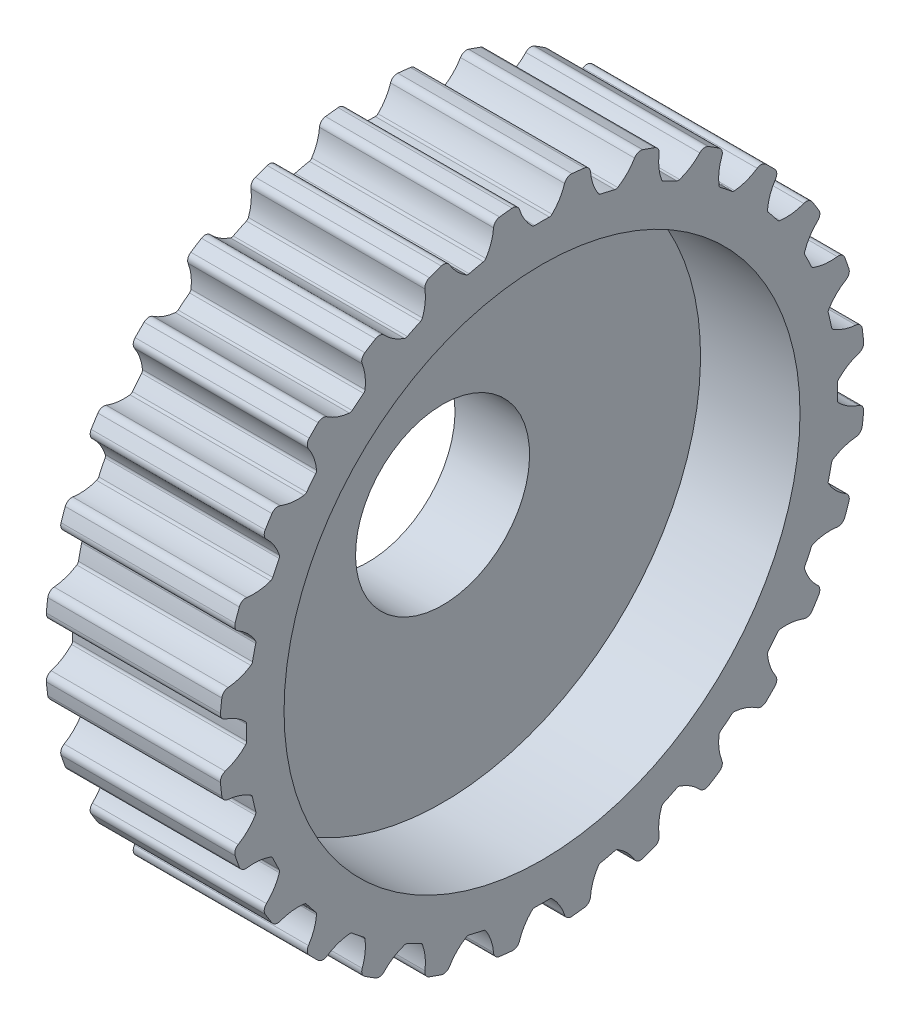
from build123d import *

# Parameters (mm, degrees)
SKETCH_2_W               = 11
SKETCH_2_H               = 3.5
SKETCH_3_R               = 17.99
CUT_EXTRUDE_1_DEPTH      = 7
CUT_EXTRUDE_2_DEPTH      = 24.895606291
CUT_EXTRUDE_2_DEPTH_BACK = 24.895606291
SKETCH_4_W               = 11.336535362
SKETCH_4_H               = 74.847651601
SKETCH_4_W_2             = 15.910926824
SKETCH_4_H_2             = 72.063239407
CUT_EXTRUDE_3_DEPTH      = 20.587141944
CUT_EXTRUDE_3_DEPTH_BACK = 4
SKETCH_5_R               = 10.375


with BuildPart() as part:
    # 草图1 → 旋转1 (revolve)
    with BuildSketch(Plane.XY, mode=Mode.PRIVATE) as revolve_1_sk:
        Polygon((0, 0), (0, 10), (1, 10), (1, 12.858347502), (0.495496297, 14.741180955), (1.461422123, 15), (2, 12.99), (9, 12.99), (9.538577877, 15), (10.504503703, 14.741180955), (10, 12.858347502), (10, 10), (11, 10), (11, 0), align=None)
    revolve(revolve_1_sk.sketch.rotate(Axis((11, 0, 0), (-1, 0, 0)), 270), axis=Axis((11, 0, 0), (-1, 0, 0)))

    # 草图2 → 切除-旋转1 (revolve, cut)
    with BuildSketch(Plane.XY, mode=Mode.PRIVATE) as cut_revolve_1_sk:
        with Locations((5.5, 1.75)):
            Rectangle(SKETCH_2_W, SKETCH_2_H)
    revolve(cut_revolve_1_sk.sketch.rotate(Axis((11, 0, 0), (-1, 0, 0)), 270), axis=Axis((11, 0, 0), (-1, 0, 0)), mode=Mode.SUBTRACT)

    # 草图3 → 切除-拉伸1 (cut)
    with BuildSketch(Plane(origin=(2, 0, 0), x_dir=(0, 0, -1), z_dir=(1, 0, 0))):
        Circle(SKETCH_3_R)
        with BuildLine():
            ThreePointArc((-12.934335103, 1.201280746), (-12.888789145, 1.020492007), (-12.739828866, 0.908376719))
            ThreePointArc((-12.739828866, 0.908376719), (-12.297942757, 0.706183324), (-11.918804329, 0.402210374))
            ThreePointArc((-11.918804329, 0.402210374), (-11.886657294, 0.352337458), (-11.876364008, 0.293901271))
            ThreePointArc((-11.876364008, 0.293901271), (-11.88, 0), (-11.876364008, -0.293901271))
            ThreePointArc((-11.876364008, -0.293901271), (-11.886657302, -0.352337477), (-11.918804359, -0.402210404))
            ThreePointArc((-11.918804359, -0.402210404), (-12.297942801, -0.706183351), (-12.739828923, -0.908376737))
            ThreePointArc((-12.739828923, -0.908376737), (-12.888789162, -1.020492032), (-12.934335103, -1.201280746))
            ThreePointArc((-12.934335103, -1.201280746), (-12.908321607, -1.454418545), (-12.877354431, -1.706998197))
            ThreePointArc((-12.877354431, -1.706998197), (-12.792721126, -1.873119256), (-12.622547594, -1.9492768))
            ThreePointArc((-12.622547594, -1.9492768), (-12.146748229, -2.048071874), (-11.709475248, -2.260057351))
            ThreePointArc((-11.709475248, -2.260057351), (-11.667036439, -2.301526461), (-11.643997952, -2.356207058))
            ThreePointArc((-11.643997952, -2.356207058), (-11.582143597, -2.643548695), (-11.513199581, -2.929272164))
            ThreePointArc((-11.513199581, -2.929272164), (-11.510231522, -2.988533726), (-11.530474814, -3.044309627))
            ThreePointArc((-11.530474814, -3.044309627), (-11.83246712, -3.425027578), (-12.218281974, -3.720480466))
            ThreePointArc((-12.218281974, -3.720480466), (-12.338559474, -3.862931583), (-12.342734194, -4.049322488))
            ThreePointArc((-12.342734194, -4.049322488), (-12.261044455, -4.29032503), (-12.174649437, -4.529681124))
            ThreePointArc((-12.174649437, -4.529681124), (-12.055172652, -4.672804499), (-11.872319078, -4.70918544))
            ThreePointArc((-11.872319078, -4.70918544), (-11.386465071, -4.699628192), (-10.912984272, -4.808996331))
            ThreePointArc((-10.912984272, -4.808996331), (-10.862381694, -4.8399822), (-10.827753217, -4.888165327))
            ThreePointArc((-10.827753217, -4.888165327), (-10.703510151, -5.154538821), (-10.572715252, -5.417757118))
            ThreePointArc((-10.572715252, -5.417757118), (-10.556634671, -5.474872414), (-10.563959116, -5.533754454))
            ThreePointArc((-10.563959116, -5.533754454), (-10.77366213, -5.97212662), (-11.084059347, -6.346023769))
            ThreePointArc((-11.084059347, -6.346023769), (-11.169622884, -6.511667605), (-11.132217052, -6.694314267))
            ThreePointArc((-11.132217052, -6.694314267), (-10.998947337, -6.911096691), (-10.861456683, -7.125226924))
            ThreePointArc((-10.861456683, -7.125226924), (-10.713127484, -7.238175812), (-10.526762909, -7.232955859))
            ThreePointArc((-10.526762909, -7.232955859), (-10.05521696, -7.115525543), (-9.569270608, -7.116792206))
            ThreePointArc((-9.569270608, -7.116792206), (-9.513041742, -7.135741063), (-9.468559724, -7.175010575))
            ThreePointArc((-9.468559724, -7.175010575), (-9.288158012, -7.407058846), (-9.102070833, -7.634573108))
            ThreePointArc((-9.102070833, -7.634573108), (-9.073684076, -7.686678138), (-9.067722396, -7.745713725))
            ThreePointArc((-9.067722396, -7.745713725), (-9.174620733, -8.219758296), (-9.394035702, -8.653350942))
            ThreePointArc((-9.394035702, -8.653350942), (-9.440594761, -8.833881415), (-9.363484071, -9.003625161))
            ThreePointArc((-9.363484071, -9.003625161), (-9.185317076, -9.185317099), (-9.003625138, -9.363484094))
            ThreePointArc((-9.003625138, -9.363484094), (-8.833881369, -9.440594765), (-8.653350892, -9.394035669))
            ThreePointArc((-8.653350892, -9.394035669), (-8.219758288, -9.17462073), (-7.745713767, -9.0677224))
            ThreePointArc((-7.745713767, -9.0677224), (-7.686678158, -9.07368407), (-7.634573108, -9.102070833))
            ThreePointArc((-7.634573108, -9.102070833), (-7.407058846, -9.288158012), (-7.175010575, -9.468559724))
            ThreePointArc((-7.175010575, -9.468559724), (-7.135741074, -9.513041724), (-7.116792211, -9.569270566))
            ThreePointArc((-7.116792211, -9.569270566), (-7.115525544, -10.055216969), (-7.23295588, -10.526762965))
            ThreePointArc((-7.23295588, -10.526762965), (-7.238175796, -10.713127532), (-7.12522689, -10.861456706))
            ThreePointArc((-7.12522689, -10.861456706), (-6.911096656, -10.998947359), (-6.694314232, -11.132217073))
            ThreePointArc((-6.694314232, -11.132217073), (-6.511667555, -11.169622877), (-6.346023728, -11.084059304))
            ThreePointArc((-6.346023728, -11.084059304), (-5.972126613, -10.773662125), (-5.533754494, -10.563959129))
            ThreePointArc((-5.533754494, -10.563959129), (-5.474872435, -10.556634669), (-5.417757118, -10.572715252))
            ThreePointArc((-5.417757118, -10.572715252), (-5.154538821, -10.703510151), (-4.888165327, -10.827753217))
            ThreePointArc((-4.888165327, -10.827753217), (-4.839982218, -10.862381675), (-4.808996348, -10.912984224))
            ThreePointArc((-4.808996348, -10.912984224), (-4.699628191, -11.386465075), (-4.709185449, -11.872319137))
            ThreePointArc((-4.709185449, -11.872319137), (-4.672804473, -12.055172696), (-4.529681085, -12.174649452))
            ThreePointArc((-4.529681085, -12.174649452), (-4.290324995, -12.261044468), (-4.049322457, -12.342734204))
            ThreePointArc((-4.049322457, -12.342734204), (-3.86293154, -12.338559457), (-3.720480436, -12.218281922))
            ThreePointArc((-3.720480436, -12.218281922), (-3.425027542, -11.832467084), (-3.044309591, -11.530474792))
            ThreePointArc((-3.044309591, -11.530474792), (-2.988533705, -11.510231519), (-2.929272164, -11.513199581))
            ThreePointArc((-2.929272164, -11.513199581), (-2.643548695, -11.582143597), (-2.356207058, -11.643997952))
            ThreePointArc((-2.356207058, -11.643997952), (-2.301526443, -11.667036451), (-2.260057328, -11.709475284))
            ThreePointArc((-2.260057328, -11.709475284), (-2.048071858, -12.146748277), (-1.949276795, -12.622547653))
            ThreePointArc((-1.949276795, -12.622547653), (-1.873119224, -12.79272116), (-1.706998165, -12.877354436))
            ThreePointArc((-1.706998165, -12.877354436), (-1.454418528, -12.908321608), (-1.201280746, -12.934335103))
            ThreePointArc((-1.201280746, -12.934335103), (-1.020492007, -12.888789145), (-0.908376719, -12.739828866))
            ThreePointArc((-0.908376719, -12.739828866), (-0.706183324, -12.297942757), (-0.402210374, -11.918804329))
            ThreePointArc((-0.402210374, -11.918804329), (-0.352337458, -11.886657294), (-0.293901271, -11.876364008))
            ThreePointArc((-0.293901271, -11.876364008), (0, -11.88), (0.293901271, -11.876364008))
            ThreePointArc((0.293901271, -11.876364008), (0.352337477, -11.886657302), (0.402210404, -11.918804359))
            ThreePointArc((0.402210404, -11.918804359), (0.706183351, -12.297942801), (0.908376737, -12.739828923))
            ThreePointArc((0.908376737, -12.739828923), (1.020492032, -12.888789162), (1.201280746, -12.934335103))
            ThreePointArc((1.201280746, -12.934335103), (1.454418545, -12.908321607), (1.706998197, -12.877354431))
            ThreePointArc((1.706998197, -12.877354431), (1.873119256, -12.792721126), (1.9492768, -12.622547594))
            ThreePointArc((1.9492768, -12.622547594), (2.048071876, -12.146748225), (2.260057356, -11.709475241))
            ThreePointArc((2.260057356, -11.709475241), (2.301526465, -11.667036436), (2.356207058, -11.643997952))
            ThreePointArc((2.356207058, -11.643997952), (2.643548695, -11.582143597), (2.929272164, -11.513199581))
            ThreePointArc((2.929272164, -11.513199581), (2.988533726, -11.510231522), (3.044309627, -11.530474814))
            ThreePointArc((3.044309627, -11.530474814), (3.425027578, -11.83246712), (3.720480466, -12.218281974))
            ThreePointArc((3.720480466, -12.218281974), (3.862931583, -12.338559474), (4.049322488, -12.342734194))
            ThreePointArc((4.049322488, -12.342734194), (4.29032503, -12.261044455), (4.529681124, -12.174649437))
            ThreePointArc((4.529681124, -12.174649437), (4.672804499, -12.055172652), (4.70918544, -11.872319078))
            ThreePointArc((4.70918544, -11.872319078), (4.699628192, -11.386465071), (4.808996331, -10.912984272))
            ThreePointArc((4.808996331, -10.912984272), (4.8399822, -10.862381694), (4.888165327, -10.827753217))
            ThreePointArc((4.888165327, -10.827753217), (5.154538821, -10.703510151), (5.417757118, -10.572715252))
            ThreePointArc((5.417757118, -10.572715252), (5.474872414, -10.556634671), (5.533754454, -10.563959116))
            ThreePointArc((5.533754454, -10.563959116), (5.97212662, -10.77366213), (6.346023769, -11.084059347))
            ThreePointArc((6.346023769, -11.084059347), (6.511667605, -11.169622884), (6.694314267, -11.132217052))
            ThreePointArc((6.694314267, -11.132217052), (6.911096691, -10.998947337), (7.125226924, -10.861456683))
            ThreePointArc((7.125226924, -10.861456683), (7.238175812, -10.713127484), (7.232955859, -10.526762909))
            ThreePointArc((7.232955859, -10.526762909), (7.115525543, -10.055216965), (7.116792205, -9.569270617))
            ThreePointArc((7.116792205, -9.569270617), (7.135741061, -9.513041746), (7.175010575, -9.468559724))
            ThreePointArc((7.175010575, -9.468559724), (7.407058846, -9.288158012), (7.634573108, -9.102070833))
            ThreePointArc((7.634573108, -9.102070833), (7.686678138, -9.073684076), (7.745713725, -9.067722396))
            ThreePointArc((7.745713725, -9.067722396), (8.219758296, -9.174620733), (8.653350942, -9.394035702))
            ThreePointArc((8.653350942, -9.394035702), (8.833881415, -9.440594761), (9.003625161, -9.363484071))
            ThreePointArc((9.003625161, -9.363484071), (9.185317099, -9.185317076), (9.363484094, -9.003625138))
            ThreePointArc((9.363484094, -9.003625138), (9.440594765, -8.833881369), (9.394035669, -8.653350892))
            ThreePointArc((9.394035669, -8.653350892), (9.17462073, -8.219758288), (9.0677224, -7.745713767))
            ThreePointArc((9.0677224, -7.745713767), (9.07368407, -7.686678158), (9.102070833, -7.634573108))
            ThreePointArc((9.102070833, -7.634573108), (9.288158012, -7.407058846), (9.468559724, -7.175010575))
            ThreePointArc((9.468559724, -7.175010575), (9.513041724, -7.135741074), (9.569270566, -7.116792211))
            ThreePointArc((9.569270566, -7.116792211), (10.05521691, -7.115525537), (10.526762854, -7.232955838))
            ThreePointArc((10.526762854, -7.232955838), (10.713127436, -7.238175827), (10.86145666, -7.125226959))
            ThreePointArc((10.86145666, -7.125226959), (10.998947337, -6.911096691), (11.132217073, -6.694314232))
            ThreePointArc((11.132217073, -6.694314232), (11.169622877, -6.511667555), (11.084059304, -6.346023728))
            ThreePointArc((11.084059304, -6.346023728), (10.773662125, -5.972126613), (10.563959129, -5.533754494))
            ThreePointArc((10.563959129, -5.533754494), (10.556634669, -5.474872435), (10.572715252, -5.417757118))
            ThreePointArc((10.572715252, -5.417757118), (10.703510151, -5.154538821), (10.827753217, -4.888165327))
            ThreePointArc((10.827753217, -4.888165327), (10.862381675, -4.839982218), (10.912984224, -4.808996348))
            ThreePointArc((10.912984224, -4.808996348), (11.386465016, -4.699628198), (11.872319019, -4.709185432))
            ThreePointArc((11.872319019, -4.709185432), (12.055172645, -4.672804503), (12.174649452, -4.529681085))
            ThreePointArc((12.174649452, -4.529681085), (12.261044468, -4.290324995), (12.342734204, -4.049322457))
            ThreePointArc((12.342734204, -4.049322457), (12.338559457, -3.86293154), (12.218281922, -3.720480436))
            ThreePointArc((12.218281922, -3.720480436), (11.832467117, -3.425027575), (11.530474841, -3.044309671))
            ThreePointArc((11.530474841, -3.044309671), (11.510231526, -2.988533751), (11.513199581, -2.929272164))
            ThreePointArc((11.513199581, -2.929272164), (11.582143597, -2.643548695), (11.643997952, -2.356207058))
            ThreePointArc((11.643997952, -2.356207058), (11.667036451, -2.301526443), (11.709475284, -2.260057328))
            ThreePointArc((11.709475284, -2.260057328), (12.146748281, -2.048071857), (12.62254766, -1.949276795))
            ThreePointArc((12.62254766, -1.949276795), (12.792721162, -1.873119222), (12.877354436, -1.706998165))
            ThreePointArc((12.877354436, -1.706998165), (12.908321608, -1.454418528), (12.934335103, -1.201280746))
            ThreePointArc((12.934335103, -1.201280746), (12.888789145, -1.020492007), (12.739828866, -0.908376719))
            ThreePointArc((12.739828866, -0.908376719), (12.297942793, -0.706183346), (11.918804388, -0.402210435))
            ThreePointArc((11.918804388, -0.402210435), (11.88665731, -0.352337497), (11.876364008, -0.293901271))
            ThreePointArc((11.876364008, -0.293901271), (11.88, 0), (11.876364008, 0.293901271))
            ThreePointArc((11.876364008, 0.293901271), (11.886657302, 0.352337477), (11.918804359, 0.402210404))
            ThreePointArc((11.918804359, 0.402210404), (12.297942804, 0.706183353), (12.73982893, 0.908376739))
            ThreePointArc((12.73982893, 0.908376739), (12.888789164, 1.020492035), (12.934335103, 1.201280746))
            ThreePointArc((12.934335103, 1.201280746), (12.908321607, 1.454418545), (12.877354431, 1.706998197))
            ThreePointArc((12.877354431, 1.706998197), (12.792721126, 1.873119256), (12.622547594, 1.9492768))
            ThreePointArc((12.622547594, 1.9492768), (12.146748274, 2.048071859), (11.709475327, 2.2600573))
            ThreePointArc((11.709475327, 2.2600573), (11.667036465, 2.301526422), (11.643997952, 2.356207058))
            ThreePointArc((11.643997952, 2.356207058), (11.582143597, 2.643548695), (11.513199581, 2.929272164))
            ThreePointArc((11.513199581, 2.929272164), (11.510231522, 2.988533726), (11.530474814, 3.044309627))
            ThreePointArc((11.530474814, 3.044309627), (11.832467125, 3.425027582), (12.218281985, 3.720480472))
            ThreePointArc((12.218281985, 3.720480472), (12.338559476, 3.862931589), (12.342734194, 4.049322488))
            ThreePointArc((12.342734194, 4.049322488), (12.261044455, 4.29032503), (12.174649437, 4.529681124))
            ThreePointArc((12.174649437, 4.529681124), (12.055172652, 4.672804499), (11.872319078, 4.70918544))
            ThreePointArc((11.872319078, 4.70918544), (11.386465071, 4.699628192), (10.912984272, 4.808996331))
            ThreePointArc((10.912984272, 4.808996331), (10.862381694, 4.8399822), (10.827753217, 4.888165327))
            ThreePointArc((10.827753217, 4.888165327), (10.703510151, 5.154538821), (10.572715252, 5.417757118))
            ThreePointArc((10.572715252, 5.417757118), (10.556634671, 5.474872414), (10.563959116, 5.533754454))
            ThreePointArc((10.563959116, 5.533754454), (10.773662094, 5.972126564), (11.084059251, 6.346023678))
            ThreePointArc((11.084059251, 6.346023678), (11.169622875, 6.51166754), (11.132217052, 6.694314267))
            ThreePointArc((11.132217052, 6.694314267), (10.998947337, 6.911096691), (10.861456683, 7.125226924))
            ThreePointArc((10.861456683, 7.125226924), (10.713127484, 7.238175812), (10.526762909, 7.232955859))
            ThreePointArc((10.526762909, 7.232955859), (10.055216918, 7.115525538), (9.569270524, 7.116792217))
            ThreePointArc((9.569270524, 7.116792217), (9.513041706, 7.135741084), (9.468559724, 7.175010575))
            ThreePointArc((9.468559724, 7.175010575), (9.288158012, 7.407058846), (9.102070833, 7.634573108))
            ThreePointArc((9.102070833, 7.634573108), (9.073684076, 7.686678138), (9.067722396, 7.745713725))
            ThreePointArc((9.067722396, 7.745713725), (9.174620713, 8.21975824), (9.394035635, 8.653350843))
            ThreePointArc((9.394035635, 8.653350843), (9.440594766, 8.833881356), (9.363484071, 9.003625161))
            ThreePointArc((9.363484071, 9.003625161), (9.185317076, 9.185317099), (9.003625138, 9.363484094))
            ThreePointArc((9.003625138, 9.363484094), (8.833881369, 9.440594765), (8.653350892, 9.394035669))
            ThreePointArc((8.653350892, 9.394035669), (8.219758248, 9.174620716), (7.745713683, 9.067722391))
            ThreePointArc((7.745713683, 9.067722391), (7.686678118, 9.073684082), (7.634573108, 9.102070833))
            ThreePointArc((7.634573108, 9.102070833), (7.407058846, 9.288158012), (7.175010575, 9.468559724))
            ThreePointArc((7.175010575, 9.468559724), (7.135741074, 9.513041724), (7.116792211, 9.569270566))
            ThreePointArc((7.116792211, 9.569270566), (7.115525536, 10.055216903), (7.232955833, 10.526762841))
            ThreePointArc((7.232955833, 10.526762841), (7.238175823, 10.713127449), (7.125226924, 10.861456683))
            ThreePointArc((7.125226924, 10.861456683), (6.911096674, 10.998947348), (6.694314232, 11.132217073))
            ThreePointArc((6.694314232, 11.132217073), (6.511667558, 11.169622877), (6.346023732, 11.084059308))
            ThreePointArc((6.346023732, 11.084059308), (5.97212661, 10.773662123), (5.533754482, 10.563959125))
            ThreePointArc((5.533754482, 10.563959125), (5.474872429, 10.556634669), (5.417757118, 10.572715252))
            ThreePointArc((5.417757118, 10.572715252), (5.154538821, 10.703510151), (4.888165327, 10.827753217))
            ThreePointArc((4.888165327, 10.827753217), (4.839982218, 10.862381675), (4.808996348, 10.912984224))
            ThreePointArc((4.808996348, 10.912984224), (4.699628198, 11.386465013), (4.709185431, 11.872319012))
            ThreePointArc((4.709185431, 11.872319012), (4.672804516, 12.055172624), (4.529681124, 12.174649437))
            ThreePointArc((4.529681124, 12.174649437), (4.290325015, 12.261044461), (4.049322457, 12.342734204))
            ThreePointArc((4.049322457, 12.342734204), (3.862931542, 12.338559458), (3.720480438, 12.218281927))
            ThreePointArc((3.720480438, 12.218281927), (3.425027548, 11.83246709), (3.044309602, 11.530474799))
            ThreePointArc((3.044309602, 11.530474799), (2.988533711, 11.51023152), (2.929272164, 11.513199581))
            ThreePointArc((2.929272164, 11.513199581), (2.643548695, 11.582143597), (2.356207058, 11.643997952))
            ThreePointArc((2.356207058, 11.643997952), (2.301526443, 11.667036451), (2.260057328, 11.709475284))
            ThreePointArc((2.260057328, 11.709475284), (2.048071879, 12.146748215), (1.949276806, 12.622547521))
            ThreePointArc((1.949276806, 12.622547521), (1.873119281, 12.7927211), (1.706998197, 12.877354431))
            ThreePointArc((1.706998197, 12.877354431), (1.454418545, 12.908321607), (1.201280746, 12.934335103))
            ThreePointArc((1.201280746, 12.934335103), (1.020492007, 12.888789145), (0.908376719, 12.739828866))
            ThreePointArc((0.908376719, 12.739828866), (0.706183324, 12.297942757), (0.402210374, 11.918804329))
            ThreePointArc((0.402210374, 11.918804329), (0.352337458, 11.886657294), (0.293901271, 11.876364008))
            ThreePointArc((0.293901271, 11.876364008), (0, 11.88), (-0.293901271, 11.876364008))
            ThreePointArc((-0.293901271, 11.876364008), (-0.352337481, 11.886657303), (-0.40221041, 11.918804364))
            ThreePointArc((-0.40221041, 11.918804364), (-0.706183318, 12.297942747), (-0.908376697, 12.739828797))
            ThreePointArc((-0.908376697, 12.739828797), (-1.020491977, 12.888789125), (-1.201280746, 12.934335103))
            ThreePointArc((-1.201280746, 12.934335103), (-1.454418545, 12.908321607), (-1.706998197, 12.877354431))
            ThreePointArc((-1.706998197, 12.877354431), (-1.873119256, 12.792721126), (-1.9492768, 12.622547594))
            ThreePointArc((-1.9492768, 12.622547594), (-2.048071859, 12.146748274), (-2.2600573, 11.709475327))
            ThreePointArc((-2.2600573, 11.709475327), (-2.301526422, 11.667036465), (-2.356207058, 11.643997952))
            ThreePointArc((-2.356207058, 11.643997952), (-2.643548695, 11.582143597), (-2.929272164, 11.513199581))
            ThreePointArc((-2.929272164, 11.513199581), (-2.988533726, 11.510231522), (-3.044309627, 11.530474814))
            ThreePointArc((-3.044309627, 11.530474814), (-3.425027578, 11.83246712), (-3.720480466, 12.218281974))
            ThreePointArc((-3.720480466, 12.218281974), (-3.862931583, 12.338559474), (-4.049322488, 12.342734194))
            ThreePointArc((-4.049322488, 12.342734194), (-4.29032503, 12.261044455), (-4.529681124, 12.174649437))
            ThreePointArc((-4.529681124, 12.174649437), (-4.672804499, 12.055172652), (-4.70918544, 11.872319078))
            ThreePointArc((-4.70918544, 11.872319078), (-4.699628192, 11.386465071), (-4.808996331, 10.912984272))
            ThreePointArc((-4.808996331, 10.912984272), (-4.8399822, 10.862381694), (-4.888165327, 10.827753217))
            ThreePointArc((-4.888165327, 10.827753217), (-5.154538821, 10.703510151), (-5.417757118, 10.572715252))
            ThreePointArc((-5.417757118, 10.572715252), (-5.474872414, 10.556634671), (-5.533754454, 10.563959116))
            ThreePointArc((-5.533754454, 10.563959116), (-5.97212662, 10.77366213), (-6.346023769, 11.084059347))
            ThreePointArc((-6.346023769, 11.084059347), (-6.511667605, 11.169622884), (-6.694314267, 11.132217052))
            ThreePointArc((-6.694314267, 11.132217052), (-6.911096691, 10.998947337), (-7.125226924, 10.861456683))
            ThreePointArc((-7.125226924, 10.861456683), (-7.238175812, 10.713127484), (-7.232955859, 10.526762909))
            ThreePointArc((-7.232955859, 10.526762909), (-7.115525543, 10.055216965), (-7.116792205, 9.569270617))
            ThreePointArc((-7.116792205, 9.569270617), (-7.135741061, 9.513041746), (-7.175010575, 9.468559724))
            ThreePointArc((-7.175010575, 9.468559724), (-7.407058846, 9.288158012), (-7.634573108, 9.102070833))
            ThreePointArc((-7.634573108, 9.102070833), (-7.686678138, 9.073684076), (-7.745713725, 9.067722396))
            ThreePointArc((-7.745713725, 9.067722396), (-8.219758296, 9.174620733), (-8.653350942, 9.394035702))
            ThreePointArc((-8.653350942, 9.394035702), (-8.833881415, 9.440594761), (-9.003625161, 9.363484071))
            ThreePointArc((-9.003625161, 9.363484071), (-9.185317099, 9.185317076), (-9.363484094, 9.003625138))
            ThreePointArc((-9.363484094, 9.003625138), (-9.440594765, 8.833881369), (-9.394035669, 8.653350892))
            ThreePointArc((-9.394035669, 8.653350892), (-9.174620716, 8.219758248), (-9.067722391, 7.745713683))
            ThreePointArc((-9.067722391, 7.745713683), (-9.073684082, 7.686678118), (-9.102070833, 7.634573108))
            ThreePointArc((-9.102070833, 7.634573108), (-9.288158012, 7.407058846), (-9.468559724, 7.175010575))
            ThreePointArc((-9.468559724, 7.175010575), (-9.513041724, 7.135741074), (-9.569270566, 7.116792211))
            ThreePointArc((-9.569270566, 7.116792211), (-10.055216969, 7.115525544), (-10.526762965, 7.23295588))
            ThreePointArc((-10.526762965, 7.23295588), (-10.713127532, 7.238175796), (-10.861456706, 7.12522689))
            ThreePointArc((-10.861456706, 7.12522689), (-10.998947359, 6.911096656), (-11.132217073, 6.694314232))
            ThreePointArc((-11.132217073, 6.694314232), (-11.169622877, 6.511667555), (-11.084059304, 6.346023728))
            ThreePointArc((-11.084059304, 6.346023728), (-10.7736621, 5.972126573), (-10.563959099, 5.533754405))
            ThreePointArc((-10.563959099, 5.533754405), (-10.556634673, 5.474872388), (-10.572715252, 5.417757118))
            ThreePointArc((-10.572715252, 5.417757118), (-10.703510151, 5.154538821), (-10.827753217, 4.888165327))
            ThreePointArc((-10.827753217, 4.888165327), (-10.862381675, 4.839982218), (-10.912984224, 4.808996348))
            ThreePointArc((-10.912984224, 4.808996348), (-11.386465075, 4.699628191), (-11.872319137, 4.709185449))
            ThreePointArc((-11.872319137, 4.709185449), (-12.055172696, 4.672804473), (-12.174649452, 4.529681085))
            ThreePointArc((-12.174649452, 4.529681085), (-12.261044468, 4.290324995), (-12.342734204, 4.049322457))
            ThreePointArc((-12.342734204, 4.049322457), (-12.338559457, 3.86293154), (-12.218281922, 3.720480436))
            ThreePointArc((-12.218281922, 3.720480436), (-11.832467084, 3.425027542), (-11.530474792, 3.044309591))
            ThreePointArc((-11.530474792, 3.044309591), (-11.510231519, 2.988533705), (-11.513199581, 2.929272164))
            ThreePointArc((-11.513199581, 2.929272164), (-11.582143597, 2.643548695), (-11.643997952, 2.356207058))
            ThreePointArc((-11.643997952, 2.356207058), (-11.667036451, 2.301526443), (-11.709475284, 2.260057328))
            ThreePointArc((-11.709475284, 2.260057328), (-12.146748277, 2.048071858), (-12.622547653, 1.949276795))
            ThreePointArc((-12.622547653, 1.949276795), (-12.79272116, 1.873119224), (-12.877354436, 1.706998165))
            ThreePointArc((-12.877354436, 1.706998165), (-12.908321608, 1.454418528), (-12.934335103, 1.201280746))
        make_face(mode=Mode.SUBTRACT)
    extrude(amount=CUT_EXTRUDE_1_DEPTH, mode=Mode.SUBTRACT)

    # 草图4 → 切除-拉伸2 (cut, two sides: drawn at the far end of the back side and taken through both)
    with BuildSketch(Plane.XY.offset(-CUT_EXTRUDE_2_DEPTH_BACK)):
        with Locations((-3.668267681, 17.668145218)):
            Rectangle(SKETCH_4_W, SKETCH_4_H)
        with Locations((16.955463412, 15.911313715)):
            Rectangle(SKETCH_4_W_2, SKETCH_4_H_2)
    extrude(amount=CUT_EXTRUDE_2_DEPTH + CUT_EXTRUDE_2_DEPTH_BACK, mode=Mode.SUBTRACT)

    # 草图5 → 切除-拉伸3 (cut, two sides: drawn at the far end of the back side and taken through both)
    with BuildSketch(Plane(origin=(9, 0, 0), x_dir=(0, 0, -1), z_dir=(1, 0, 0)).offset(-CUT_EXTRUDE_3_DEPTH_BACK)):
        with Locations(Location((0, 0, 0), (0, 0, 90))):
            Circle(SKETCH_5_R)
    extrude(amount=CUT_EXTRUDE_3_DEPTH + CUT_EXTRUDE_3_DEPTH_BACK, mode=Mode.SUBTRACT)


solid = part.part
